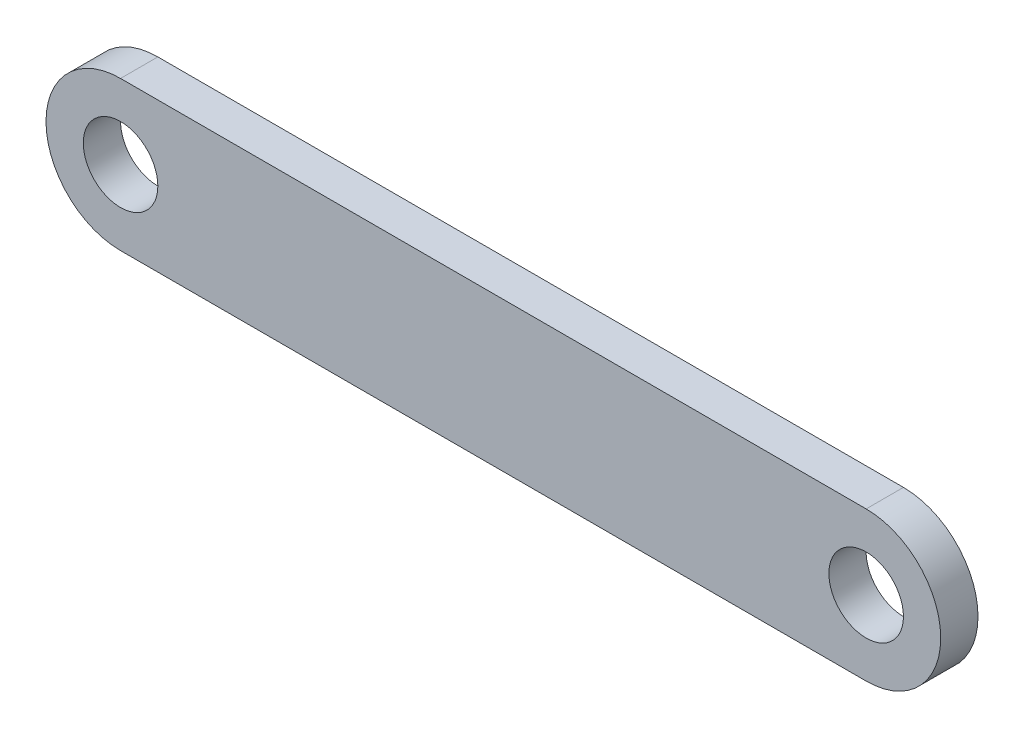
from build123d import *

# Parameters (mm, degrees)
SKETCH3_R           = 5
BOSS_EXTRUDE1_DEPTH = 5


with BuildPart() as part:
    # Sketch3 → Boss-Extrude1 (new body)
    with BuildSketch(Plane.XY):
        with BuildLine():
            Line((50, -10), (-50, -10))
            ThreePointArc((-50, -10), (-60, 0), (-50, 10))
            Line((-50, 10), (50, 10))
            ThreePointArc((50, 10), (60, 0), (50, -10))
        make_face()
        with Locations((-50, 0)):
            Circle(SKETCH3_R, mode=Mode.SUBTRACT)
        with Locations((50, 0)):
            Circle(SKETCH3_R, mode=Mode.SUBTRACT)
    extrude(amount=BOSS_EXTRUDE1_DEPTH)


solid = part.part
